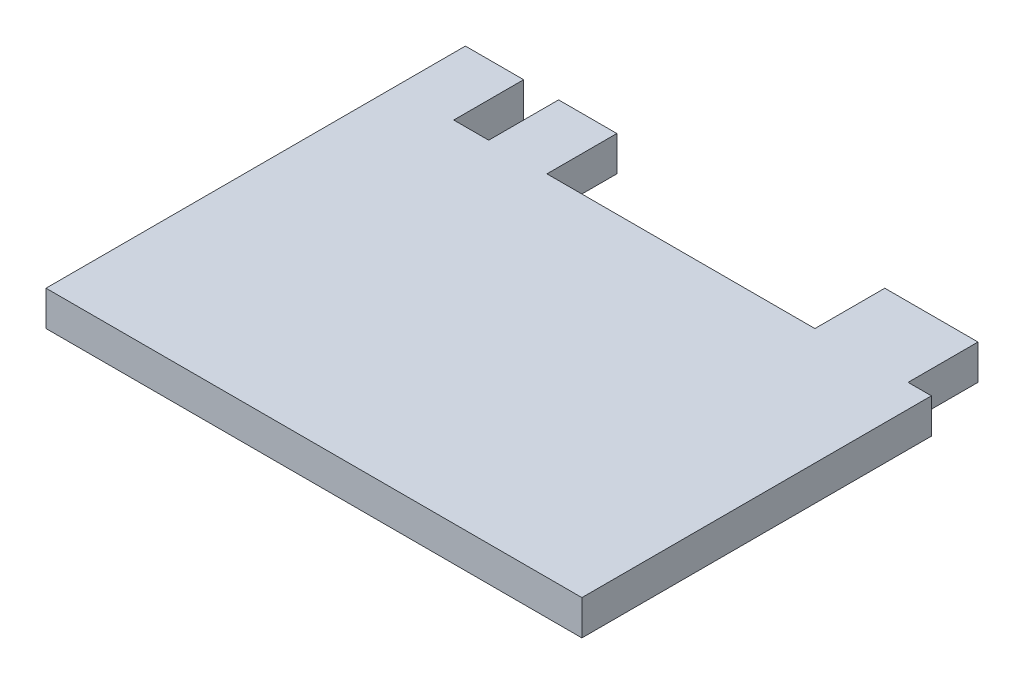
from build123d import *

# Parameters (mm, degrees)
EXTRUDE_1_DEPTH = 1.5


with BuildPart() as part:
    # Эскиз1 → Бобышка-Вытянуть1 (new body)
    with BuildSketch(Plane(origin=(0, 0, 0), x_dir=(1, 0, 0), z_dir=(0, 1, 0))):
        Polygon((10.5, 18), (6.5, 18), (6.5, 15), (-5, 15), (-5, 18), (-7.5, 18), (-7.5, 15), (-9, 15), (-9, 18), (-11.5, 18), (-11.5, 15), (-11.5, 0), (0, 0), (11.5, 0), (11.5, 15), (10.5, 15), align=None)
    extrude(amount=EXTRUDE_1_DEPTH)


solid = part.part
